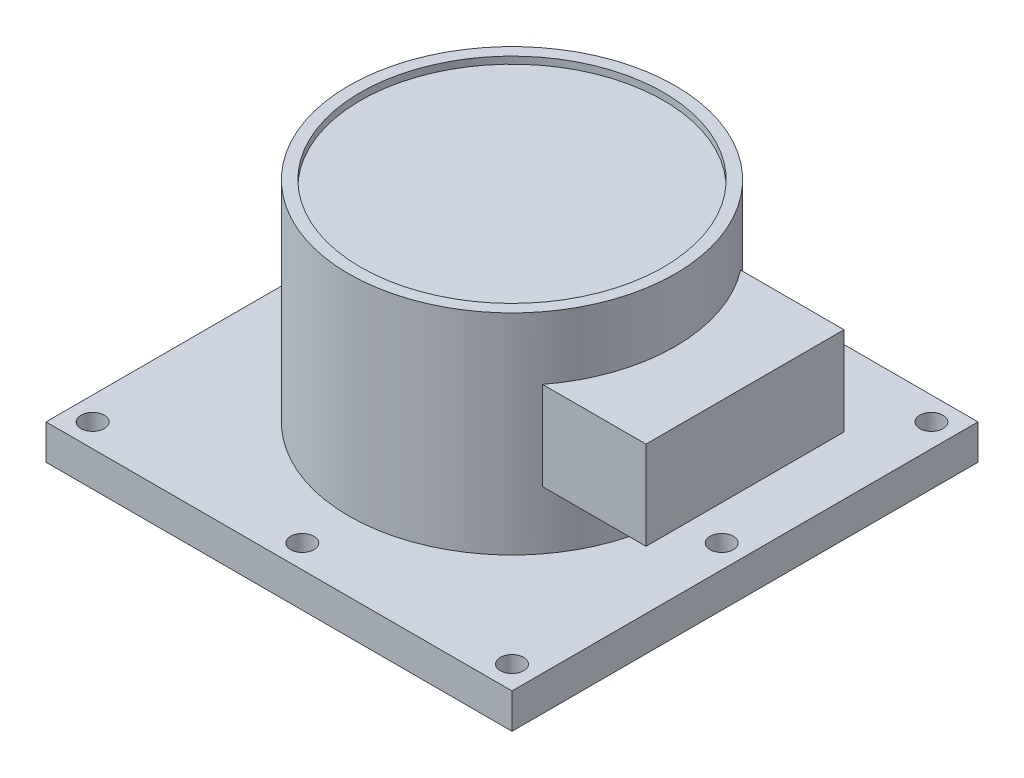
from build123d import *

# Parameters (mm, degrees)
SKETCH1_W           = 200
SKETCH1_H           = 200
BOSS_EXTRUDE1_DEPTH = 15
SKETCH2_R           = 70
BOSS_EXTRUDE2_DEPTH = 90
SKETCH4_R           = 65
CUT_EXTRUDE1_DEPTH  = 3
SKETCH5_W           = 85
SKETCH5_H           = 38
BOSS_EXTRUDE3_DEPTH = 100
SKETCH6_R           = 5
CUT_EXTRUDE2_DEPTH  = 15


with BuildPart() as part:
    # Sketch1 → Boss-Extrude1 (new body)
    with BuildSketch(Plane(origin=(0, 0, 0), x_dir=(1, 0, 0), z_dir=(0, 1, 0))):
        Rectangle(SKETCH1_W, SKETCH1_H)
    extrude(amount=BOSS_EXTRUDE1_DEPTH)

    # Sketch2 → Boss-Extrude2 (add)
    with BuildSketch(Plane(origin=(0, 15, 0), x_dir=(1, 0, 0), z_dir=(0, 1, 0))):
        Circle(SKETCH2_R)
    extrude(amount=BOSS_EXTRUDE2_DEPTH)

    # Sketch4 → Cut-Extrude1 (cut)
    with BuildSketch(Plane(origin=(0, 105, 0), x_dir=(1, 0, 0), z_dir=(0, 1, 0))):
        Circle(SKETCH4_R)
    extrude(amount=-CUT_EXTRUDE1_DEPTH, mode=Mode.SUBTRACT)

    # Sketch5 → Boss-Extrude3 (add)
    with BuildSketch(Plane(origin=(0, 0, 0), x_dir=(0, 0, -1), z_dir=(1, 0, 0))):
        with Locations((0, 59)):
            Rectangle(SKETCH5_W, SKETCH5_H)
    extrude(amount=BOSS_EXTRUDE3_DEPTH)

    # Sketch6 → Cut-Extrude2 (cut)
    with BuildSketch(Plane.XZ):
        with Locations((-90, 90)):
            Circle(SKETCH6_R)
        with Locations((0, 90)):
            Circle(SKETCH6_R)
        with Locations((90, 90)):
            Circle(SKETCH6_R)
        with Locations((90, 0)):
            Circle(SKETCH6_R)
        with Locations((90, -90)):
            Circle(SKETCH6_R)
        with Locations((-90, -90)):
            Circle(SKETCH6_R)
        with Locations((-90, 0)):
            Circle(SKETCH6_R)
        with Locations((0, -90)):
            Circle(SKETCH6_R)
    extrude(amount=-CUT_EXTRUDE2_DEPTH, mode=Mode.SUBTRACT)


solid = part.part
